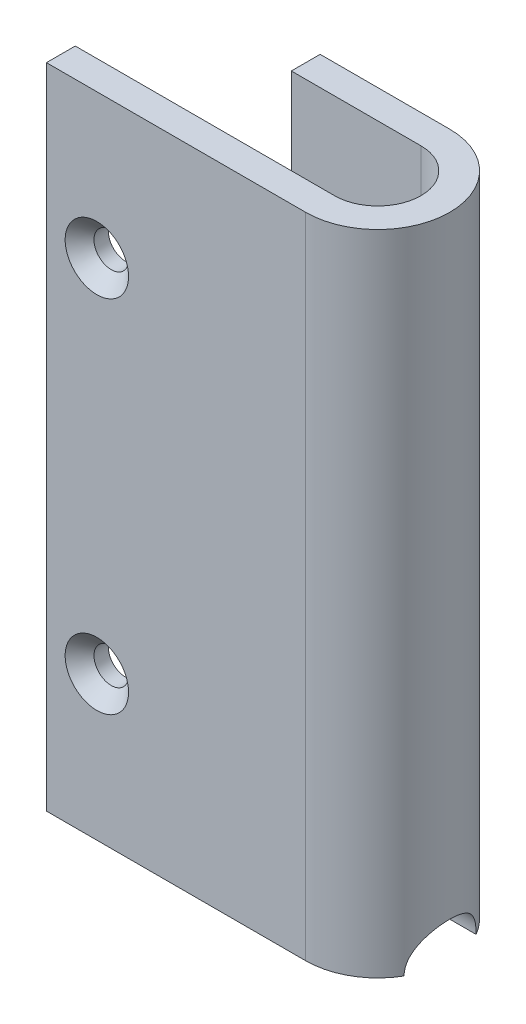
from build123d import *

# Parameters (mm, degrees)
BOSS_EXTRUDE1_DEPTH                                 = 45
SKETCH2_R                                           = 1
CUT_EXTRUDE1_DEPTH                                  = 5
SKETCH3_R                                           = 2.5
CUT_EXTRUDE2_DEPTH                                  = 6
CSK_FOR_M2_COUNTERSUNK_FLAT_HEAD_SCREW1_D           = 2.4
CSK_FOR_M2_COUNTERSUNK_FLAT_HEAD_SCREW1_CSINK_D     = 4.4
CSK_FOR_M2_COUNTERSUNK_FLAT_HEAD_SCREW1_CSINK_ANGLE = 90


with BuildPart() as part:
    # Sketch1 → Boss-Extrude1 (new body)
    with BuildSketch(Plane(origin=(0, 0, 0), x_dir=(1, 0, 0), z_dir=(0, 1, 0))):
        with BuildLine():
            Line((0, 3), (-9, 3))
            Line((-9, 3), (-9, 5))
            Line((-9, 5), (0, 5))
            ThreePointArc((0, 5), (5, 0), (0, -5))
            Line((0, -5), (-18, -5))
            Line((-18, -5), (-18, -3))
            Line((-18, -3), (0, -3))
            ThreePointArc((0, -3), (3, 0), (0, 3))
        make_face()
    extrude(amount=BOSS_EXTRUDE1_DEPTH)

    # Sketch2 → Cut-Extrude1 (cut)
    with BuildSketch(Plane(origin=(0, 0, -5), x_dir=(-1, 0, 0), z_dir=(0, 0, -1))):
        with Locations((9, 17.5)):
            Circle(SKETCH2_R)
    extrude(amount=-CUT_EXTRUDE1_DEPTH, mode=Mode.SUBTRACT)

    # Sketch3 → Cut-Extrude2 (cut)
    with BuildSketch(Plane(origin=(0, 0, 0), x_dir=(0, 0, -1), z_dir=(1, 0, 0))):
        Circle(SKETCH3_R)
    extrude(amount=CUT_EXTRUDE2_DEPTH, mode=Mode.SUBTRACT)

    # CSK for M2 Countersunk Flat Head Screw1 (through all)
    with Locations(Plane(origin=(-14.5, 35, 5), x_dir=(1, 0, 0), z_dir=(0, 0, 1))):
        with Locations((0, 0), (0, -25)):
            CounterSinkHole(CSK_FOR_M2_COUNTERSUNK_FLAT_HEAD_SCREW1_D / 2, CSK_FOR_M2_COUNTERSUNK_FLAT_HEAD_SCREW1_CSINK_D / 2, counter_sink_angle=CSK_FOR_M2_COUNTERSUNK_FLAT_HEAD_SCREW1_CSINK_ANGLE)


solid = part.part
